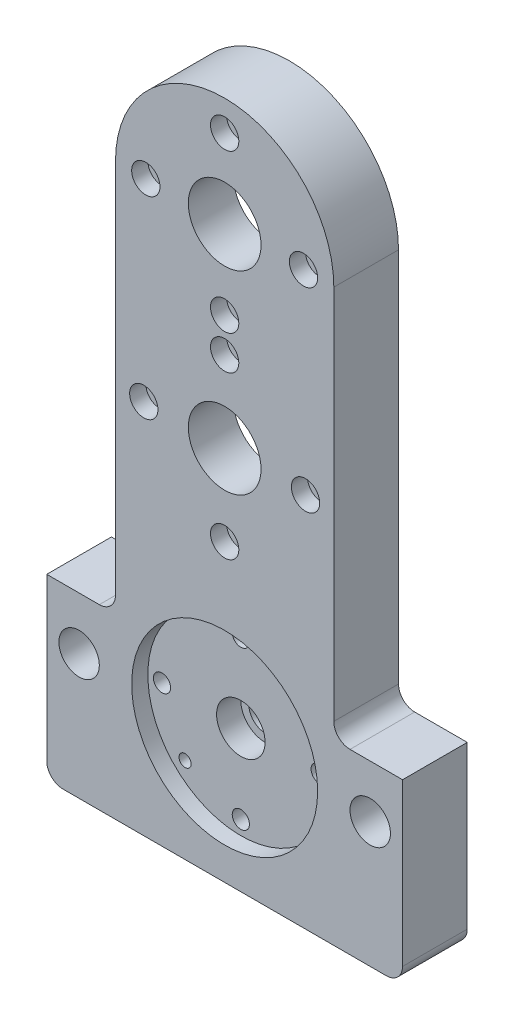
from build123d import *

# Parameters (mm, degrees)
BOLT_CIRCLE_R                                     = 14.2748
BOLT_CIRCLE_R_2                                   = 6.35
BASE_DEPTH                                        = 12.7
STRUCTURE_TUBE_CONNECTION_COUNTERBORE_D           = 6.7564
STRUCTURE_TUBE_CONNECTION_COUNTERBORE_CBORE_D     = 11.1125
STRUCTURE_TUBE_CONNECTION_COUNTERBORE_CBORE_DEPTH = 6.35
STRUCTURE_TUBE_CONNECTION_COUNTERBORE_PA_COUNT    = 4
SPINDLE_CONNECTION_COUNTERBORE_D                  = 6.7564
SPINDLE_CONNECTION_COUNTERBORE_CBORE_D            = 11.1125
SPINDLE_CONNECTION_COUNTERBORE_CBORE_DEPTH        = 6.35
SPINDLE_CONNECTION_COUNTERBORE_PATTERN_COUNT      = 4
SKETCH16_R                                        = 36.5125
STRUCTURE_TUBE_MOUNTING_POCKET_DEPTH              = 6.35
SKETCH17_R                                        = 36.5125
SPINDLE_MOUNTING_POCKET_DEPTH                     = 7.62
SKETCH18_R                                        = 9.525
LEAD_SCREW_THROUGH_HOLE_DEPTH                     = 9.525
SKETCH20_R                                        = 7.9375
RAIL_MOUNTING_PILOT_HOLES_DEPTH                   = 166.290695159
SKETCH27_R                                        = 2.38125
ALIGNMENT_FEATURES_DEPTH                          = 6.35
GENERIC_ROUNDING_FILLET_R                         = 6.35
WOOD_SPINDLE_CBORE_D                              = 6.7564
WOOD_SPINDLE_CBORE_CBORE_D                        = 11.1125
WOOD_SPINDLE_CBORE_CBORE_DEPTH                    = 6.35
CIRPATTERN1_COUNT                                 = 4
SKETCH30_R                                        = 36.5125
CUT_EXTRUDE1_DEPTH                                = 7.62


with BuildPart() as part:
    # Bolt circle → Base (new, symmetric)
    with BuildSketch(Plane.XY):
        with BuildLine():
            Line((-42.8625, 76.2), (-42.8625, -77.7875))
            Line((-42.8625, -77.7875), (-69.85, -77.7875))
            Line((-69.85, -77.7875), (-69.85, -147.6375))
            Line((-69.85, -147.6375), (69.85, -147.6375))
            Line((69.85, -147.6375), (69.85, -77.7875))
            Line((69.85, -77.7875), (42.8625, -77.7875))
            Line((42.8625, -77.7875), (42.8625, 76.2))
            ThreePointArc((42.8625, 76.2), (0, 119.0625), (-42.8625, 76.2))
        make_face()
        with Locations((0, 76.2)):
            Circle(BOLT_CIRCLE_R, mode=Mode.SUBTRACT)
        Circle(BOLT_CIRCLE_R, mode=Mode.SUBTRACT)
        with Locations((0, -98.425)):
            Circle(BOLT_CIRCLE_R_2, mode=Mode.SUBTRACT)
    extrude(amount=BASE_DEPTH, both=True)

    # Structure tube connection counterbore (through all)
    with Locations(Plane(origin=(0, 0, -12.7), x_dir=(-1, 0, 0), z_dir=(0, 0, -1))):
        with Locations((0, -67.46875)):
            structure_tube_connection_counterbore = CounterBoreHole(STRUCTURE_TUBE_CONNECTION_COUNTERBORE_D / 2, STRUCTURE_TUBE_CONNECTION_COUNTERBORE_CBORE_D / 2, STRUCTURE_TUBE_CONNECTION_COUNTERBORE_CBORE_DEPTH)

    # Structure tube connection counterbore pattern: Structure tube connection counterbore ×4 about axis
    structure_tube_connection_counterbore_pa_axis = Axis((0, -98.425, 12.7), (0, 0, -1))
    for i in range(1, STRUCTURE_TUBE_CONNECTION_COUNTERBORE_PA_COUNT):
        add(structure_tube_connection_counterbore.rotate(structure_tube_connection_counterbore_pa_axis, i * 360 / STRUCTURE_TUBE_CONNECTION_COUNTERBORE_PA_COUNT), mode=Mode.SUBTRACT)

    # Spindle connection counterbore (through all)
    with Locations(Plane.XY.offset(12.7)):
        with Locations((0, 31.75)):
            spindle_connection_counterbore = CounterBoreHole(SPINDLE_CONNECTION_COUNTERBORE_D / 2, SPINDLE_CONNECTION_COUNTERBORE_CBORE_D / 2, SPINDLE_CONNECTION_COUNTERBORE_CBORE_DEPTH)

    # Spindle connection counterbore pattern: Spindle connection counterbore ×4 about axis
    spindle_connection_counterbore_pattern_axis = Axis((0, 0, 12.7), (0, 0, -1))
    for i in range(1, SPINDLE_CONNECTION_COUNTERBORE_PATTERN_COUNT):
        add(spindle_connection_counterbore.rotate(spindle_connection_counterbore_pattern_axis, i * 360 / SPINDLE_CONNECTION_COUNTERBORE_PATTERN_COUNT), mode=Mode.SUBTRACT)

    # Sketch16 → Structure tube mounting pocket (cut)
    with BuildSketch(Plane.XY.offset(12.7)):
        with Locations((0, -98.425)):
            Circle(SKETCH16_R)
    extrude(amount=-STRUCTURE_TUBE_MOUNTING_POCKET_DEPTH, mode=Mode.SUBTRACT)

    # Sketch17 → Spindle mounting pocket (cut)
    with BuildSketch(Plane(origin=(0, 0, -12.7), x_dir=(-1, 0, 0), z_dir=(0, 0, -1))):
        Circle(SKETCH17_R)
    extrude(amount=-SPINDLE_MOUNTING_POCKET_DEPTH, mode=Mode.SUBTRACT)

    # Sketch18 → Lead screw through hole (cut)
    with BuildSketch(Plane.XY.offset(6.35)):
        with Locations((0, -98.425)):
            Circle(SKETCH18_R)
    extrude(amount=-LEAD_SCREW_THROUGH_HOLE_DEPTH, mode=Mode.SUBTRACT)

    # Sketch20 → Rail mounting pilot_holes (cut, through all)
    with BuildSketch(Plane.XY.offset(12.7)):
        with Locations((57.15, -98.425)):
            Circle(SKETCH20_R)
        with Locations((-57.15, -98.425)):
            Circle(SKETCH20_R)
    extrude(amount=-RAIL_MOUNTING_PILOT_HOLES_DEPTH, mode=Mode.SUBTRACT)

    # Sketch27 → Alignment_features (cut)
    with BuildSketch(Plane.XY.offset(6.35)):
        with Locations((-21.889374295, -120.314374295)):
            Circle(SKETCH27_R)
        with BuildLine():
            Line((20.681324246, -74.335397148), (19.602797121, -75.500272889))
            ThreePointArc((19.602797121, -75.500272889), (19.732320046, -78.865377187), (23.097424344, -78.735854262))
            Line((23.097424344, -78.735854262), (24.175951469, -77.570978521))
            ThreePointArc((24.175951469, -77.570978521), (24.046428544, -74.205874223), (20.681324246, -74.335397148))
        make_face()
    extrude(amount=-ALIGNMENT_FEATURES_DEPTH, mode=Mode.SUBTRACT)

    # Generic_rounding_fillet
    generic_rounding_fillet_edges = [part.edges().sort_by_distance(p)[0] for p in [
        (42.8625, -77.7875, 0),
        (-42.8625, -77.7875, 0),
        (-69.85, -147.6375, 0),
        (69.85, -147.6375, 0),
    ]]
    fillet(generic_rounding_fillet_edges, radius=GENERIC_ROUNDING_FILLET_R)

    # wood_spindle_CBORE (through all)
    with Locations(Plane.XY.offset(12.7)):
        with Locations((0, 107.15625)):
            wood_spindle_cbore = CounterBoreHole(WOOD_SPINDLE_CBORE_D / 2, WOOD_SPINDLE_CBORE_CBORE_D / 2, WOOD_SPINDLE_CBORE_CBORE_DEPTH)

    # CirPattern1: wood_spindle_CBORE ×4 about axis
    cirpattern1_axis = Axis((0, 76.2, 12.7), (0, 0, -1))
    for i in range(1, CIRPATTERN1_COUNT):
        add(wood_spindle_cbore.rotate(cirpattern1_axis, i * 360 / CIRPATTERN1_COUNT), mode=Mode.SUBTRACT)

    # Sketch30 → Cut-Extrude1 (cut)
    with BuildSketch(Plane(origin=(0, 0, -12.7), x_dir=(-1, 0, 0), z_dir=(0, 0, -1))):
        with Locations((0, 76.2)):
            Circle(SKETCH30_R)
    extrude(amount=-CUT_EXTRUDE1_DEPTH, mode=Mode.SUBTRACT)


solid = part.part
